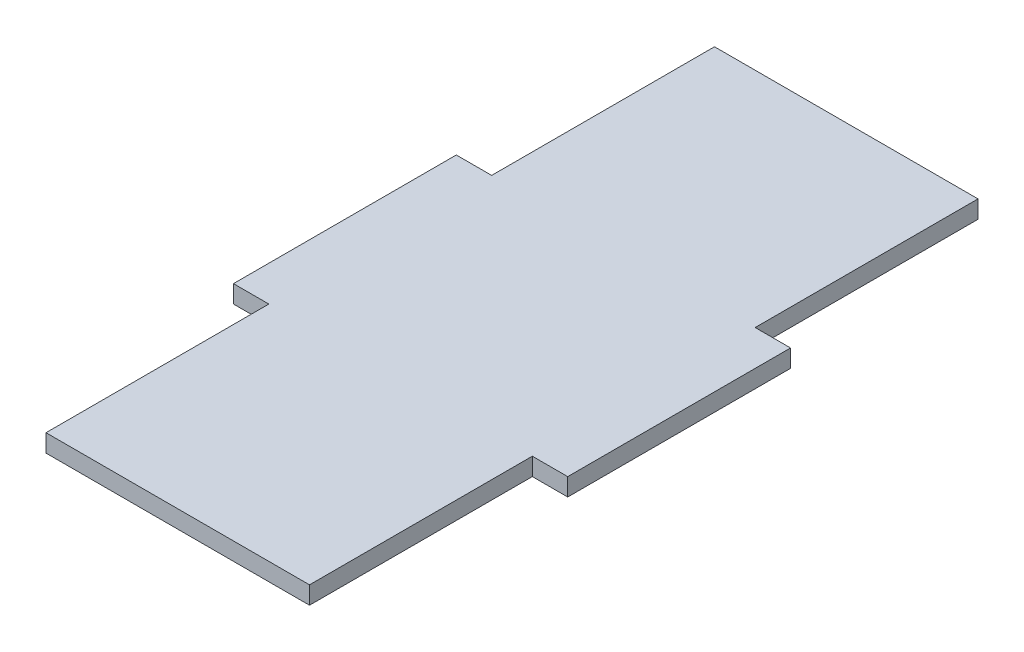
from build123d import *

# Parameters (mm, degrees)
BOSS_EXTRUDE1_DEPTH = 3.175


with BuildPart() as part:
    # Sketch1 → Boss-Extrude1 (new body)
    with BuildSketch(Plane(origin=(0, 0, 0), x_dir=(1, 0, 0), z_dir=(0, 1, 0))):
        Polygon((23.65, 60), (-23.65, 60), (-23.65, 20), (-30, 20), (-30, -20), (-23.65, -20), (-23.65, -60), (23.65, -60), (23.65, -20), (30, -20), (30, 20), (23.65, 20), align=None)
    extrude(amount=BOSS_EXTRUDE1_DEPTH)


solid = part.part
